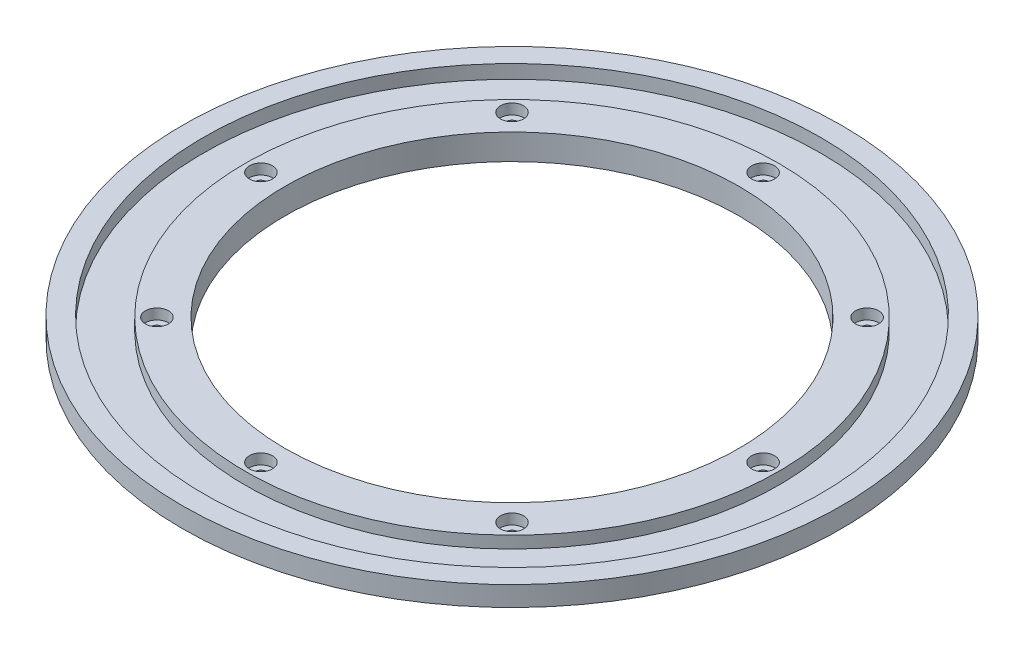
from build123d import *

# Parameters (mm, degrees)
SKETCH4_R          = 5
CUT_EXTRUDE1_DEPTH = 447.150479099
SKETCH5_R          = 11
CUT_EXTRUDE2_DEPTH = 10


with BuildPart() as part:
    # Sketch3 → Revolve1 (revolve)
    with BuildSketch(Plane(origin=(0, 0, 0), x_dir=(0, 0, -1), z_dir=(1, 0, 0)), mode=Mode.PRIVATE) as revolve1_sk:
        Polygon((-315, 34.712328767), (-295, 34.712328767), (-295, 21.712328767), (-255, 21.712328767), (-255, 33.212328767), (-217, 33.212328767), (-217, 8.712328767), (-229, 8.712328767), (-229, 15.712328767), (-315, 15.712328767), align=None)
    revolve(revolve1_sk.sketch.rotate(Axis((0, -1465.136435986, 0), (0, 1, 0)), 180), axis=Axis((0, -1465.136435986, 0), (0, 1, 0)))

    # Sketch4 → Cut-Extrude1 (cut, through all)
    with BuildSketch(Plane(origin=(0, 33.212328767, 0), x_dir=(1, 0, 0), z_dir=(0, 1, 0))):
        with Locations(Location((0, 240, 0), (0, 0, 270))):
            Circle(SKETCH4_R)
        with Locations(Location((169.705627485, 169.705627485, 0), (0, 0, 270))):
            Circle(SKETCH4_R)
        with Locations(Location((240, 0, 0), (0, 0, 270))):
            Circle(SKETCH4_R)
        with Locations(Location((169.705627485, -169.705627485, 0), (0, 0, 270))):
            Circle(SKETCH4_R)
        with Locations(Location((0, -240, 0), (0, 0, 270))):
            Circle(SKETCH4_R)
        with Locations(Location((-169.705627485, -169.705627485, 0), (0, 0, 270))):
            Circle(SKETCH4_R)
        with Locations(Location((-240, 0, 0), (0, 0, 270))):
            Circle(SKETCH4_R)
        with Locations(Location((-169.705627485, 169.705627485, 0), (0, 0, 270))):
            Circle(SKETCH4_R)
    extrude(amount=-CUT_EXTRUDE1_DEPTH, mode=Mode.SUBTRACT)

    # Sketch5 → Cut-Extrude2 (cut)
    with BuildSketch(Plane(origin=(0, 33.212328767, 0), x_dir=(1, 0, 0), z_dir=(0, 1, 0))):
        with Locations(Location((0, 240, 0), (0, 0, 270))):
            Circle(SKETCH5_R)
        with Locations(Location((169.705627485, 169.705627485, 0), (0, 0, 270))):
            Circle(SKETCH5_R)
        with Locations(Location((240, 0, 0), (0, 0, 270))):
            Circle(SKETCH5_R)
        with Locations(Location((169.705627485, -169.705627485, 0), (0, 0, 270))):
            Circle(SKETCH5_R)
        with Locations(Location((0, -240, 0), (0, 0, 270))):
            Circle(SKETCH5_R)
        with Locations(Location((-169.705627485, -169.705627485, 0), (0, 0, 270))):
            Circle(SKETCH5_R)
        with Locations(Location((-240, 0, 0), (0, 0, 270))):
            Circle(SKETCH5_R)
        with Locations(Location((-169.705627485, 169.705627485, 0), (0, 0, 270))):
            Circle(SKETCH5_R)
    extrude(amount=-CUT_EXTRUDE2_DEPTH, mode=Mode.SUBTRACT)


solid = part.part
